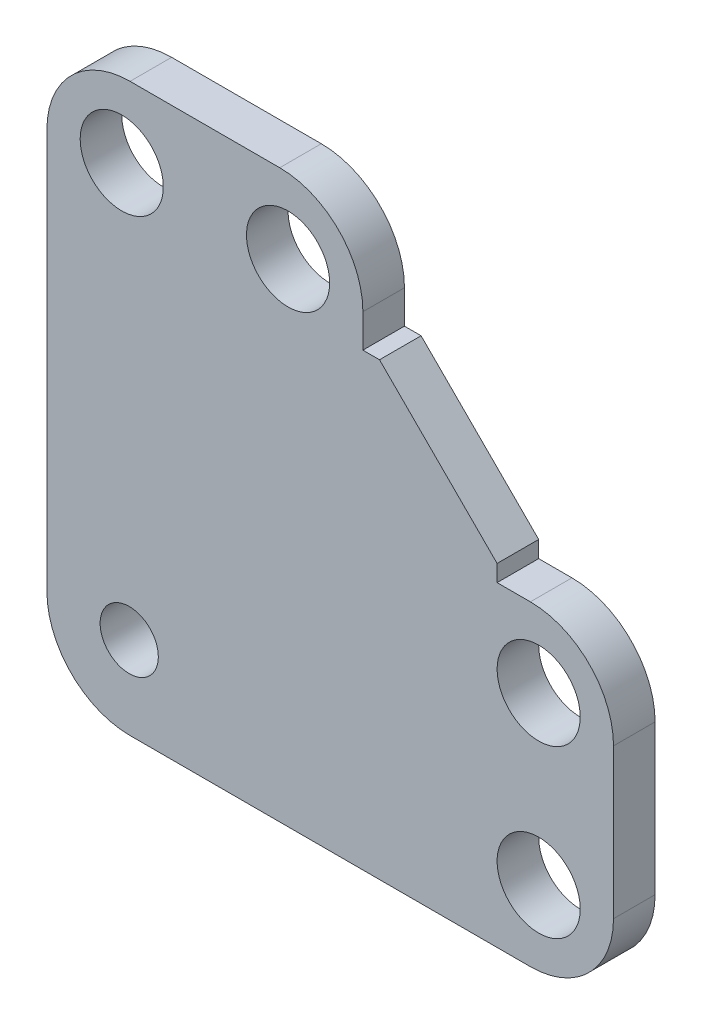
from build123d import *

# Parameters (mm, degrees)
BOSS_EXTRU_1_DEPTH      = 5
ESQUISSE3_W             = 38
ESQUISSE3_H             = 14
ESQUISSE3_W_2           = 14
ESQUISSE3_H_2           = 38
BOSS_EXTRU_2_DEPTH      = 5
ESQUISSE4_R             = 5
ESQUISSE4_R_2           = 3.5
ENL_V_MAT_EXTRU_2_DEPTH = 97.497156926
CONG_1_R                = 10


with BuildPart() as part:
    # Esquisse1 → Boss.-Extru.1 (new body)
    with BuildSketch(Plane.XY):
        Polygon((0, 0), (54.142135624, 0), (54.142135624, 40), (40, 54.142135624), (0, 54.142135624), align=None)
    extrude(amount=BOSS_EXTRU_1_DEPTH)

    # Esquisse3 → Boss.-Extru.2 (add)
    with BuildSketch(Plane.XY.offset(5)):
        with Locations((19, 61.142135624)):
            Rectangle(ESQUISSE3_W, ESQUISSE3_H)
        with Locations((61.142135624, 19)):
            Rectangle(ESQUISSE3_W_2, ESQUISSE3_H_2)
    extrude(amount=-BOSS_EXTRU_2_DEPTH)

    # Esquisse4 → Enlèv. mat.-Extru.2 (cut, through all)
    with BuildSketch(Plane.XY.offset(5)):
        with Locations((29, 59.142135624)):
            Circle(ESQUISSE4_R)
        with Locations(Location((9, 59.142135624, 0), (0, 0, 180))):
            Circle(ESQUISSE4_R)
        with Locations((59.142135624, 9)):
            Circle(ESQUISSE4_R)
        with Locations(Location((59.142135624, 29, 0), (0, 0, 180))):
            Circle(ESQUISSE4_R)
        with Locations((9.899494937, 9.899494937)):
            Circle(ESQUISSE4_R_2)
    extrude(amount=-ENL_V_MAT_EXTRU_2_DEPTH, mode=Mode.SUBTRACT)

    # Congé1
    cong_1_edges = [part.edges().sort_by_distance(p)[0] for p in [
        (0, 68.142135624, 2.5),
        (38, 68.142135624, 2.5),
        (68.142135624, 38, 2.5),
        (68.142135624, 0, 2.5),
        (0, 0, 2.5),
    ]]
    fillet(cong_1_edges, radius=CONG_1_R)


solid = part.part
